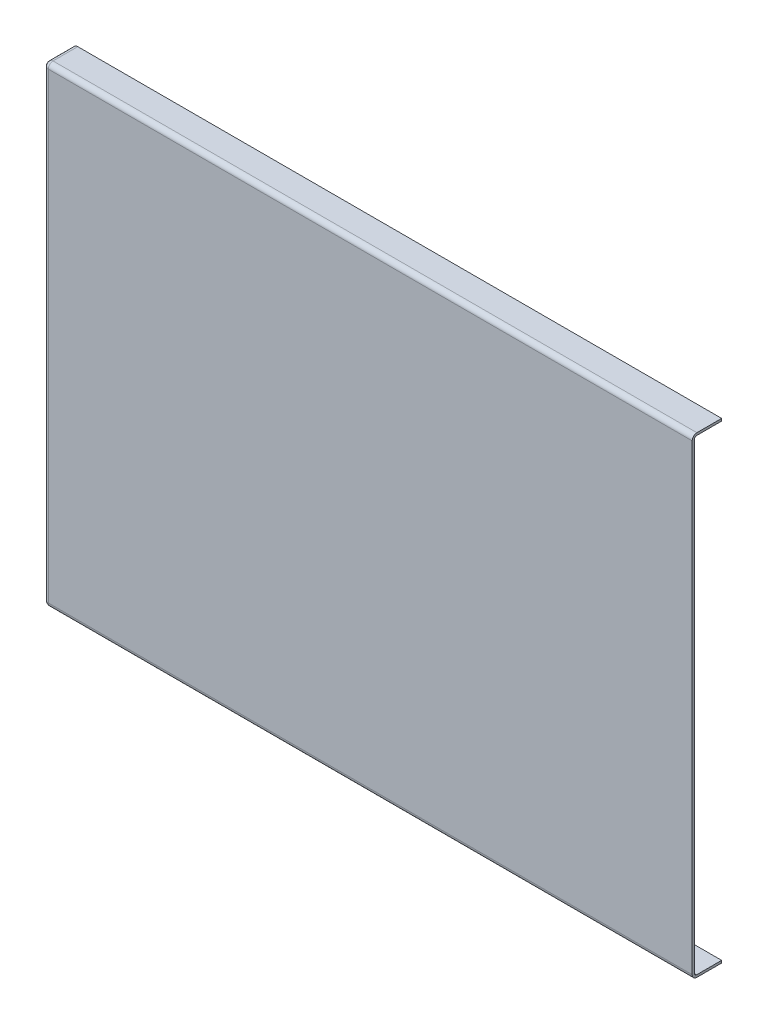
from build123d import *

# Parameters (mm, degrees)
SKETCH_1_W      = 550
SKETCH_1_H      = 400
EXTRUDE_1_DEPTH = 25
FILLET_1_R      = 4
SHELL_1_T       = -2


with BuildPart() as part:
    # 草图1 → 凸台-拉伸1 (new body)
    with BuildSketch(Plane.XY):
        with Locations((275, 200)):
            Rectangle(SKETCH_1_W, SKETCH_1_H)
    extrude(amount=-EXTRUDE_1_DEPTH)

    # 圆角1
    fillet_1_edges = [part.edges().sort_by_distance(p)[0] for p in [
        (275, 400, 0),
        (275, 0, 0),
        (0, 200, 0),
        (0, 400, -12.5),
        (0, 0, -12.5),
    ]]
    fillet(fillet_1_edges, radius=FILLET_1_R)

    # 抽壳1
    shell_1_openings = [part.faces().sort_by_distance(p)[0] for p in [
        (275.008556451, 200, -25),
        (550, 200, -12.507975981),
    ]]
    offset(amount=SHELL_1_T, openings=shell_1_openings, kind=Kind.INTERSECTION)


solid = part.part
